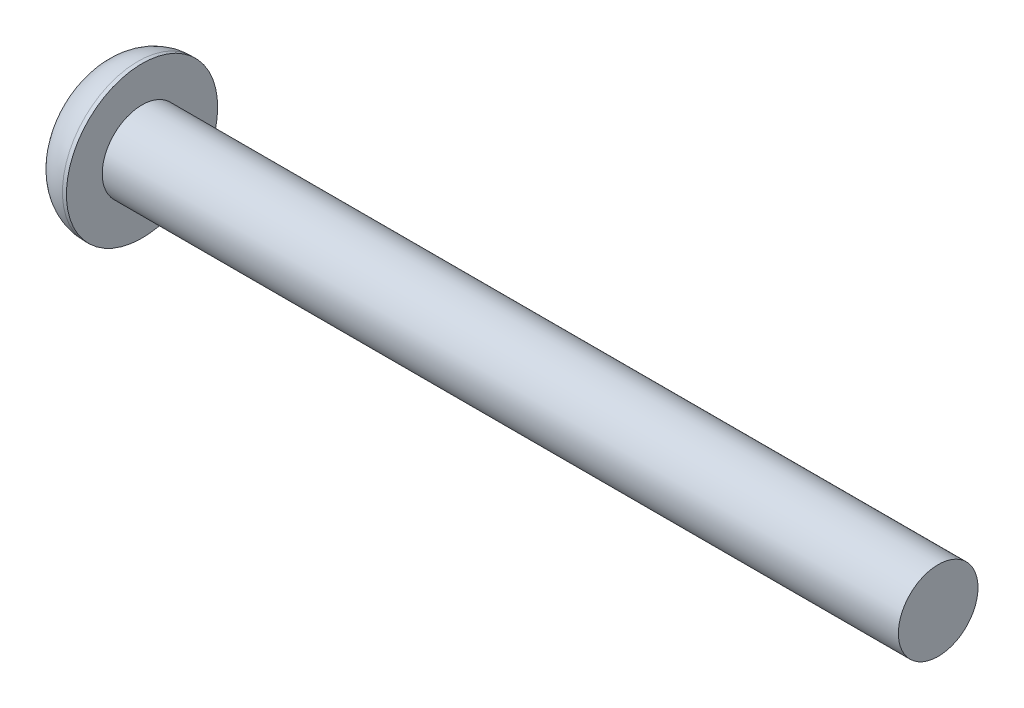
from build123d import *

# Parameters (mm, degrees)
CUT_EXTRUDE1_DEPTH = 1.04


with BuildPart() as part:
    # Sketch1 → Revolve1 (revolve)
    with BuildSketch(Plane(origin=(0, 0, 0), x_dir=(1, 0, 0), z_dir=(0, 1, 0))):
        with BuildLine():
            Line((0, 0), (31.65, 0))
            Line((31.65, 0), (31.65, 1.5))
            Line((31.65, 1.5), (1.65, 1.5))
            Line((1.65, 1.5), (1.65, 2.85))
            Line((1.65, 2.85), (1.5, 2.85))
            ThreePointArc((1.5, 2.85), (0.439339828, 2.410660172), (0, 1.35))
            Line((0, 1.35), (0, 0))
        make_face()
    revolve(axis=Axis((0, 0, 0), (-1, 0, 0)))

    # Sketch2 → Cut-Extrude1 (cut)
    with BuildSketch(Plane.ZY):
        Polygon((1.154700538, 0), (0.577350269, 1), (-0.577350269, 1), (-1.154700538, 0), (-0.577350269, -1), (0.577350269, -1), align=None)
    extrude(amount=-CUT_EXTRUDE1_DEPTH, mode=Mode.SUBTRACT)


solid = part.part
